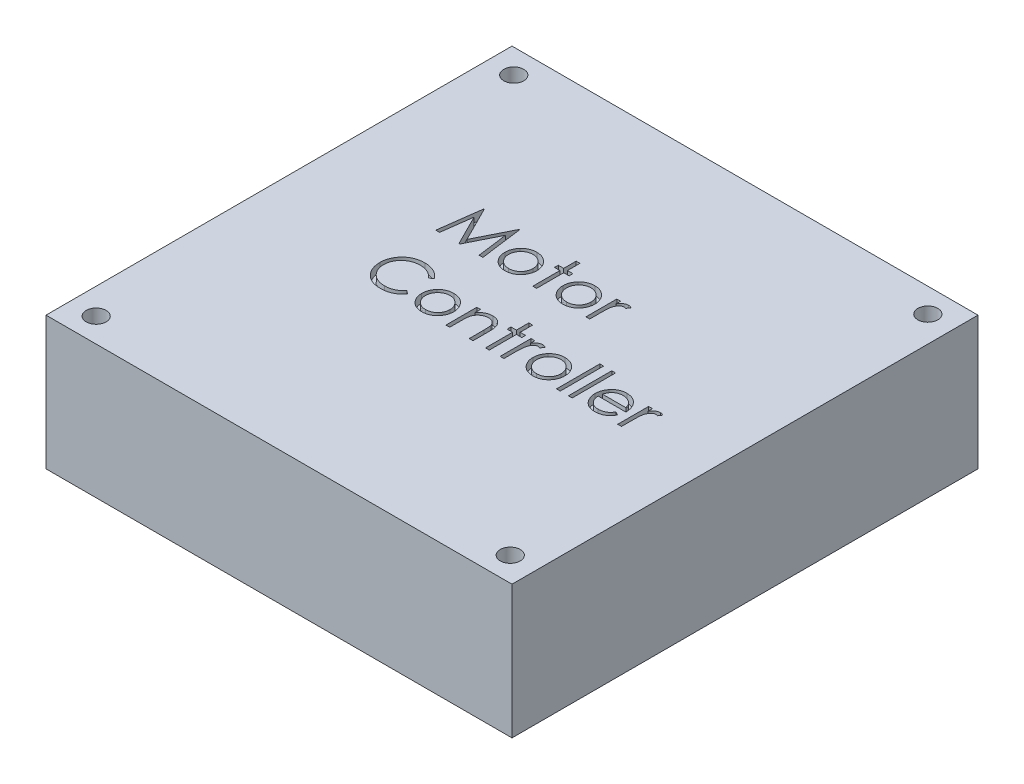
from build123d import *

# Parameters (mm, degrees)
SKETCH1_W             = 70
SKETCH1_H             = 70
BOSS_EXTRUDE1_DEPTH   = 20
SKETCH2_W             = 0.569871795
SKETCH2_H             = 6.512820513
CUT_EXTRUDE1_DEPTH    = 1.27
F_3_0MM_DOWEL_HOLE1_D = 3


with BuildPart() as part:
    # Sketch1 → Boss-Extrude1 (new body)
    with BuildSketch(Plane(origin=(0, 0, 0), x_dir=(1, 0, 0), z_dir=(0, 1, 0))):
        Rectangle(SKETCH1_W, SKETCH1_H)
    extrude(amount=BOSS_EXTRUDE1_DEPTH)

    # Sketch2 → Cut-Extrude1 (cut)
    # profile 1 of 15: a face of its own
    with BuildSketch(Plane(origin=(0, 20, 0), x_dir=(1, 0, 0), z_dir=(0, 1, 0))):
        Polygon((-16.77700151, 5.328013988), (-15.938730276, 11.678013988), (-15.85732002, 11.678013988), (-13.235655356, 6.467757577), (-10.620350869, 11.678013988), (-10.537668577, 11.678013988), (-9.694309202, 5.328013988), (-10.266725068, 5.328013988), (-10.87475792, 9.897164629), (-13.166965452, 5.328013988), (-13.295441013, 5.328013988), (-15.596552792, 9.907340911), (-16.203313609, 5.328013988), align=None)
    # profile 2 of 15: a face of its own
    with BuildSketch(Plane(origin=(0, 20, 0), x_dir=(1, 0, 0), z_dir=(0, 1, 0))):
        with BuildLine():
            add(Edge.make_bspline(
                [(-6.313239491, 10.049808859), (-6.22616961, 10.047954857), (-6.055446853, 10.044319611), (-5.805423974, 10.005466745), (-5.566763513, 9.946053669), (-5.338551422, 9.863918121), (-5.123710428, 9.753823725), (-4.919111171, 9.622452583), (-4.725314598, 9.466818449), (-4.609158531, 9.346425953), (-4.550198625, 9.28531567)],
                knots=[0, 0, 0, 0, 1.054011418, 2.066658804, 3.057071809, 4.030435133, 4.997543892, 5.974964718, 6.972108034, 8, 8, 8, 8], degree=3))
            add(Edge.make_bspline(
                [(-4.550198625, 9.28531567), (-4.499431366, 9.226870296), (-4.398879333, 9.111110627), (-4.269945815, 8.923412586), (-4.158872413, 8.729029832), (-4.069858184, 8.525381111), (-3.999672498, 8.314244207), (-3.949841877, 8.094893416), (-3.92020201, 7.867813157), (-3.916205198, 7.713591908), (-3.914180997, 7.635485943)],
                knots=[0, 0, 0, 0, 1.025258237, 2.030674902, 3.01204498, 3.988269485, 4.97094183, 5.956517959, 6.965070386, 8, 8, 8, 8], degree=3))
            add(Edge.make_bspline(
                [(-3.914180997, 7.635485943), (-3.915961423, 7.556927267), (-3.919479629, 7.401691659), (-3.95276019, 7.173056524), (-4.004523731, 6.951360203), (-4.078604352, 6.737530858), (-4.173596922, 6.530914872), (-4.289512883, 6.332414689), (-4.427165675, 6.141638676), (-4.583201497, 5.96020677), (-4.755652758, 5.792990923), (-4.942734913, 5.647252491), (-5.140771517, 5.522390582), (-5.352395887, 5.421813085), (-5.57567547, 5.342511201), (-5.811091865, 5.286812599), (-6.05827935, 5.253136402), (-6.227057308, 5.248811919), (-6.313239491, 5.246603731)],
                knots=[0, 0, 0, 0, 0.998656419, 1.973391657, 2.932242238, 3.890759089, 4.846373663, 5.82037756, 6.809684879, 7.83454468, 8.860553229, 9.859544525, 10.845671541, 11.83227036, 12.833544569, 13.85385346, 14.904124723, 16, 16, 16, 16], degree=3))
            add(Edge.make_bspline(
                [(-6.313239491, 5.246603731), (-6.39984391, 5.24881933), (-6.569463042, 5.253158692), (-6.817523037, 5.286681762), (-7.053361346, 5.342485531), (-7.276933232, 5.422073696), (-7.489467454, 5.522393797), (-7.688651527, 5.646875005), (-7.87588566, 5.793034144), (-8.048373403, 5.960195058), (-8.204399444, 6.141641693), (-8.342054759, 6.332413906), (-8.457970065, 6.530915076), (-8.552962806, 6.737530804), (-8.627043381, 6.951360217), (-8.678806935, 7.17305652), (-8.712087493, 7.40169166), (-8.715605699, 7.556927267), (-8.717386125, 7.635485943)],
                knots=[0, 0, 0, 0, 1.099876186, 2.154163076, 3.173186993, 4.173200201, 5.163417411, 6.152872554, 7.150605724, 8.17532212, 9.198891216, 10.186952605, 11.159729845, 12.11414092, 13.071450619, 14.029093627, 15.002601286, 16, 16, 16, 16], degree=3))
            add(Edge.make_bspline(
                [(-8.717386125, 7.635485943), (-8.715348119, 7.71316739), (-8.711313218, 7.866963306), (-8.681703151, 8.093616688), (-8.632066913, 8.312596236), (-8.561797094, 8.522918171), (-8.471962391, 8.725674462), (-8.362449768, 8.920537513), (-8.232201049, 9.107386808), (-8.132048937, 9.222996868), (-8.081368497, 9.281499565)],
                knots=[0, 0, 0, 0, 1.031353054, 2.041901799, 3.029428768, 4.008703097, 4.981709435, 5.96992636, 6.972712378, 8, 8, 8, 8], degree=3))
            add(Edge.make_bspline(
                [(-8.081368497, 9.281499565), (-8.022497482, 9.343139811), (-7.906717272, 9.464366203), (-7.711956009, 9.61954664), (-7.507860076, 9.753651517), (-7.290644853, 9.861558365), (-7.062620239, 9.946536818), (-6.822736756, 10.005619967), (-6.571865464, 10.044179625), (-6.400307294, 10.047913748), (-6.313239491, 10.049808859)],
                knots=[0, 0, 0, 0, 1.027980169, 2.021703884, 2.998553061, 3.971491411, 4.943284454, 5.930300938, 6.949603206, 8, 8, 8, 8], degree=3))
        make_face()
        with BuildLine():
            add(Edge.make_bspline(
                [(-6.315783561, 9.479937065), (-6.377356085, 9.47818702), (-6.498911647, 9.474732107), (-6.67783575, 9.448454166), (-6.850084315, 9.406820837), (-7.015984133, 9.347667763), (-7.174975745, 9.271288332), (-7.327211375, 9.177474593), (-7.473138802, 9.067469086), (-7.609903403, 8.941443954), (-7.735419883, 8.803777778), (-7.845144212, 8.657095755), (-7.938444048, 8.503777098), (-8.016168337, 8.343662373), (-8.074057092, 8.175128993), (-8.116099576, 8.000085562), (-8.142352726, 7.818175449), (-8.145775156, 7.694511888), (-8.14751433, 7.631669837)],
                knots=[0, 0, 0, 0, 1.021534396, 2.016698045, 2.994645724, 3.958388632, 4.93408049, 5.916473867, 6.921342795, 7.962252576, 8.998418191, 10.008913653, 10.997312074, 11.973003931, 12.956656626, 13.948281152, 14.957379055, 16, 16, 16, 16], degree=3))
            add(Edge.make_bspline(
                [(-8.14751433, 7.631669837), (-8.144599093, 7.550476873), (-8.138812893, 7.389324023), (-8.091758964, 7.151995272), (-8.013043856, 6.924153912), (-7.906749791, 6.707135612), (-7.773569937, 6.506344479), (-7.616657688, 6.327326214), (-7.437697089, 6.172774813), (-7.238821438, 6.044539565), (-7.02409289, 5.942649723), (-6.796842136, 5.870443009), (-6.559822591, 5.823504368), (-6.397841836, 5.818838978), (-6.315783561, 5.816475526)],
                knots=[0, 0, 0, 0, 1.016792936, 2.018143844, 3.017858371, 4.030088057, 5.03801393, 6.028138512, 7.003788237, 7.991172063, 8.984598303, 9.972568034, 10.972917682, 12, 12, 12, 12], degree=3))
            add(Edge.make_bspline(
                [(-6.315783561, 5.816475526), (-6.233730006, 5.818852749), (-6.071758568, 5.823545321), (-5.835068347, 5.870206608), (-5.608438712, 5.942966106), (-5.393933195, 6.044424973), (-5.195148072, 6.173261783), (-5.01490038, 6.326453495), (-4.8593279, 6.506818626), (-4.726279788, 6.707401571), (-4.618244983, 6.923817467), (-4.539898317, 7.152037324), (-4.492731269, 7.389313314), (-4.486960336, 7.550473285), (-4.484052792, 7.631669837)],
                knots=[0, 0, 0, 0, 1.02726834, 2.027799167, 3.010890988, 4.004497153, 4.992059811, 5.971914811, 6.958719428, 7.966827853, 8.981595046, 9.981490638, 10.983022906, 12, 12, 12, 12], degree=3))
            add(Edge.make_bspline(
                [(-4.484052792, 7.631669837), (-4.485791368, 7.694512263), (-4.489212619, 7.818176564), (-4.51547434, 8.000081301), (-4.557485105, 8.175144626), (-4.615490753, 8.34360469), (-4.692877321, 8.504191662), (-4.78797636, 8.656645595), (-4.897252649, 8.8042859), (-5.024283711, 8.940998934), (-5.160905554, 9.067518215), (-5.306892123, 9.17751725), (-5.458902013, 9.27087603), (-5.617431727, 9.348321067), (-5.783352814, 9.40628267), (-5.955360034, 9.448694558), (-6.133520732, 9.474621058), (-6.254640711, 9.478153729), (-6.315783561, 9.479937065)],
                knots=[0, 0, 0, 0, 1.042956736, 2.052379634, 3.044323526, 4.02829302, 5.004299113, 5.996692471, 7.007513377, 8.048758398, 9.090003419, 10.095195979, 11.07790575, 12.047570684, 13.018257071, 13.989683339, 14.985167495, 16, 16, 16, 16], degree=3))
        make_face(mode=Mode.SUBTRACT)
    # profile 3 of 15: a face of its own
    with BuildSketch(Plane(origin=(0, 20, 0), x_dir=(1, 0, 0), z_dir=(0, 1, 0))):
        Polygon((-2.204565613, 11.8408345), (-1.634693818, 11.8408345), (-1.634693818, 9.968398603), (-0.820591254, 9.968398603), (-0.820591254, 9.398526808), (-1.634693818, 9.398526808), (-1.634693818, 5.328013988), (-2.204565613, 5.328013988), (-2.204565613, 9.398526808), (-3.018668177, 9.398526808), (-3.018668177, 9.968398603), (-2.204565613, 9.968398603), align=None)
    # profile 4 of 15: a face of its own
    with BuildSketch(Plane(origin=(0, 20, 0), x_dir=(1, 0, 0), z_dir=(0, 1, 0))):
        with BuildLine():
            add(Edge.make_bspline(
                [(2.397657945, 10.049808859), (2.484727826, 10.047954857), (2.655450583, 10.044319611), (2.905473462, 10.005466745), (3.144133923, 9.946053669), (3.372346014, 9.863918121), (3.587187007, 9.753823725), (3.791786265, 9.622452583), (3.985582838, 9.466818449), (4.101738905, 9.346425953), (4.160698811, 9.28531567)],
                knots=[0, 0, 0, 0, 1.054011418, 2.066658804, 3.057071809, 4.030435133, 4.997543892, 5.974964718, 6.972108034, 8, 8, 8, 8], degree=3))
            add(Edge.make_bspline(
                [(4.160698811, 9.28531567), (4.21146607, 9.226870296), (4.312018103, 9.111110627), (4.440951621, 8.923412586), (4.552025023, 8.729029832), (4.641039252, 8.525381111), (4.711224938, 8.314244207), (4.761055559, 8.094893416), (4.790695426, 7.867813157), (4.794692238, 7.713591908), (4.796716439, 7.635485943)],
                knots=[0, 0, 0, 0, 1.025258237, 2.030674902, 3.01204498, 3.988269485, 4.97094183, 5.956517959, 6.965070386, 8, 8, 8, 8], degree=3))
            add(Edge.make_bspline(
                [(4.796716439, 7.635485943), (4.794936012, 7.556927267), (4.791417807, 7.401691659), (4.758137246, 7.173056524), (4.706373704, 6.951360203), (4.632293084, 6.737530858), (4.537300514, 6.530914872), (4.421384552, 6.332414689), (4.283731761, 6.141638676), (4.127695939, 5.96020677), (3.955244678, 5.792990923), (3.768162523, 5.647252491), (3.570125919, 5.522390582), (3.358501549, 5.421813085), (3.135221966, 5.342511201), (2.899805571, 5.286812599), (2.652618086, 5.253136402), (2.483840127, 5.248811919), (2.397657945, 5.246603731)],
                knots=[0, 0, 0, 0, 0.998656419, 1.973391657, 2.932242238, 3.890759089, 4.846373663, 5.82037756, 6.809684879, 7.83454468, 8.860553229, 9.859544525, 10.845671541, 11.83227036, 12.833544569, 13.85385346, 14.904124723, 16, 16, 16, 16], degree=3))
            add(Edge.make_bspline(
                [(2.397657945, 5.246603731), (2.311053525, 5.24881933), (2.141434394, 5.253158692), (1.893374399, 5.286681762), (1.65753609, 5.342485531), (1.433964204, 5.422073696), (1.221429982, 5.522393797), (1.022245909, 5.646875005), (0.835011776, 5.793034144), (0.662524033, 5.960195058), (0.506497992, 6.141641693), (0.368842677, 6.332413906), (0.252927371, 6.530915076), (0.157934629, 6.737530804), (0.083854055, 6.951360217), (0.032090501, 7.17305652), (-0.001190057, 7.40169166), (-0.004708263, 7.556927267), (-0.006488689, 7.635485943)],
                knots=[0, 0, 0, 0, 1.099876186, 2.154163076, 3.173186993, 4.173200201, 5.163417411, 6.152872554, 7.150605724, 8.17532212, 9.198891216, 10.186952605, 11.159729845, 12.11414092, 13.071450619, 14.029093627, 15.002601286, 16, 16, 16, 16], degree=3))
            add(Edge.make_bspline(
                [(-0.006488689, 7.635485943), (-0.004450684, 7.71316739), (-0.000415782, 7.866963306), (0.029194284, 8.093616688), (0.078830523, 8.312596236), (0.149100342, 8.522918171), (0.238935045, 8.725674462), (0.348447668, 8.920537513), (0.478696387, 9.107386808), (0.578848499, 9.222996868), (0.629528939, 9.281499565)],
                knots=[0, 0, 0, 0, 1.031353054, 2.041901799, 3.029428768, 4.008703097, 4.981709435, 5.96992636, 6.972712378, 8, 8, 8, 8], degree=3))
            add(Edge.make_bspline(
                [(0.629528939, 9.281499565), (0.688399954, 9.343139811), (0.804180164, 9.464366203), (0.998941427, 9.61954664), (1.20303736, 9.753651517), (1.420252583, 9.861558365), (1.648277197, 9.946536818), (1.88816068, 10.005619967), (2.139031972, 10.044179625), (2.310590142, 10.047913748), (2.397657945, 10.049808859)],
                knots=[0, 0, 0, 0, 1.027980169, 2.021703884, 2.998553061, 3.971491411, 4.943284454, 5.930300938, 6.949603206, 8, 8, 8, 8], degree=3))
        make_face()
        with BuildLine():
            add(Edge.make_bspline(
                [(2.395113875, 9.479937065), (2.333541351, 9.47818702), (2.211985789, 9.474732107), (2.033061686, 9.448454166), (1.860813121, 9.406820837), (1.694913303, 9.347667763), (1.535921691, 9.271288332), (1.38368606, 9.177474593), (1.237758634, 9.067469086), (1.100994033, 8.941443954), (0.975477552, 8.803777778), (0.865753224, 8.657095755), (0.772453388, 8.503777098), (0.694729099, 8.343662373), (0.636840344, 8.175128993), (0.59479786, 8.000085562), (0.56854471, 7.818175449), (0.56512228, 7.694511888), (0.563383105, 7.631669837)],
                knots=[0, 0, 0, 0, 1.021534396, 2.016698045, 2.994645724, 3.958388632, 4.93408049, 5.916473867, 6.921342795, 7.962252576, 8.998418191, 10.008913653, 10.997312074, 11.973003931, 12.956656626, 13.948281152, 14.957379055, 16, 16, 16, 16], degree=3))
            add(Edge.make_bspline(
                [(0.563383105, 7.631669837), (0.566298343, 7.550476873), (0.572084543, 7.389324023), (0.619138472, 7.151995272), (0.69785358, 6.924153912), (0.804147645, 6.707135612), (0.937327498, 6.506344479), (1.094239748, 6.327326214), (1.273200347, 6.172774813), (1.472075998, 6.044539565), (1.686804546, 5.942649723), (1.9140553, 5.870443009), (2.151074845, 5.823504368), (2.3130556, 5.818838978), (2.395113875, 5.816475526)],
                knots=[0, 0, 0, 0, 1.016792936, 2.018143844, 3.017858371, 4.030088057, 5.03801393, 6.028138512, 7.003788237, 7.991172063, 8.984598303, 9.972568034, 10.972917682, 12, 12, 12, 12], degree=3))
            add(Edge.make_bspline(
                [(2.395113875, 5.816475526), (2.47716743, 5.818852749), (2.639138868, 5.823545321), (2.875829089, 5.870206608), (3.102458724, 5.942966106), (3.316964241, 6.044424973), (3.515749364, 6.173261783), (3.695997056, 6.326453495), (3.851569536, 6.506818626), (3.984617648, 6.707401571), (4.092652453, 6.923817467), (4.170999119, 7.152037324), (4.218166167, 7.389313314), (4.223937099, 7.550473285), (4.226844644, 7.631669837)],
                knots=[0, 0, 0, 0, 1.02726834, 2.027799167, 3.010890988, 4.004497153, 4.992059811, 5.971914811, 6.958719428, 7.966827853, 8.981595046, 9.981490638, 10.983022906, 12, 12, 12, 12], degree=3))
            add(Edge.make_bspline(
                [(4.226844644, 7.631669837), (4.225106068, 7.694512263), (4.221684817, 7.818176564), (4.195423096, 8.000081301), (4.153412331, 8.175144626), (4.095406683, 8.34360469), (4.018020115, 8.504191662), (3.922921076, 8.656645595), (3.813644787, 8.8042859), (3.686613725, 8.940998934), (3.549991882, 9.067518215), (3.404005313, 9.17751725), (3.251995423, 9.27087603), (3.093465709, 9.348321067), (2.927544622, 9.40628267), (2.755537401, 9.448694558), (2.577376703, 9.474621058), (2.456256725, 9.478153729), (2.395113875, 9.479937065)],
                knots=[0, 0, 0, 0, 1.042956736, 2.052379634, 3.044323526, 4.02829302, 5.004299113, 5.996692471, 7.007513377, 8.048758398, 9.090003419, 10.095195979, 11.07790575, 12.047570684, 13.018257071, 13.989683339, 14.985167495, 16, 16, 16, 16], degree=3))
        make_face(mode=Mode.SUBTRACT)
    # profile 5 of 15: a face of its own
    with BuildSketch(Plane(origin=(0, 20, 0), x_dir=(1, 0, 0), z_dir=(0, 1, 0))):
        with BuildLine():
            Line((5.773639516, 9.968398603), (6.343511311, 9.968398603))
            Line((6.343511311, 9.968398603), (6.343511311, 9.28531567))
            add(Edge.make_bspline(
                [(6.343511311, 9.28531567), (6.385582344, 9.348916959), (6.466042869, 9.470553929), (6.599779184, 9.631425375), (6.736763799, 9.764621245), (6.877652496, 9.870763344), (7.023481335, 9.950252859), (7.171049804, 10.008478794), (7.322679585, 10.042909066), (7.424573362, 10.047505847), (7.475622689, 10.049808859)],
                knots=[0, 0, 0, 0, 1.2804753, 2.448899062, 3.506932113, 4.484331642, 5.4025378, 6.288909075, 7.142734305, 8, 8, 8, 8], degree=3))
            add(Edge.make_bspline(
                [(7.475622689, 10.049808859), (7.515221881, 10.047648904), (7.596699793, 10.043204655), (7.720039634, 10.011979302), (7.847118469, 9.962126318), (7.929019657, 9.915244772), (7.971716439, 9.890804452)],
                knots=[0, 0, 0, 0, 0.901110191, 1.854092781, 2.881294221, 4, 4, 4, 4], degree=3))
            Line((7.971716439, 9.890804452), (7.658795766, 9.397254773))
            add(Edge.make_bspline(
                [(7.658795766, 9.397254773), (7.631383684, 9.409483541), (7.579350307, 9.432696085), (7.503232736, 9.460168018), (7.43305374, 9.476344036), (7.388343284, 9.478794624), (7.367499692, 9.479937065)],
                knots=[0, 0, 0, 0, 1.180555205, 2.24091978, 3.179933427, 4, 4, 4, 4], degree=3))
            add(Edge.make_bspline(
                [(7.367499692, 9.479937065), (7.32176929, 9.476888997), (7.228492525, 9.470671822), (7.091542076, 9.421797128), (6.958650718, 9.342829907), (6.853110702, 9.255252318), (6.771391186, 9.170801314), (6.713079634, 9.097053498), (6.659589507, 9.014360838), (6.608480679, 8.924136983), (6.561914688, 8.824841405), (6.518454074, 8.717466146), (6.479158708, 8.601886841), (6.456751836, 8.521364269), (6.445274131, 8.480117353)],
                knots=[0, 0, 0, 0, 1.125678352, 2.296057538, 3.5422874, 4.923748041, 5.663163013, 6.437101912, 7.23742474, 8.08941207, 8.991984279, 9.93940061, 10.944477711, 12, 12, 12, 12], degree=3))
            add(Edge.make_bspline(
                [(6.445274131, 8.480117353), (6.436688217, 8.443328767), (6.417671071, 8.361844843), (6.39918071, 8.225141091), (6.380911727, 8.063626739), (6.368036434, 7.876852206), (6.356101986, 7.665283915), (6.349370837, 7.428599557), (6.343740853, 7.166556191), (6.343590146, 6.983359864), (6.343511311, 6.887529212)],
                knots=[0, 0, 0, 0, 0.566838948, 1.255505196, 2.06880316, 3.007127437, 4.065329342, 5.249902469, 6.561414163, 8, 8, 8, 8], degree=3))
            Line((6.343511311, 6.887529212), (6.343511311, 5.328013988))
            Line((6.343511311, 5.328013988), (5.773639516, 5.328013988))
            Line((5.773639516, 5.328013988), (5.773639516, 9.968398603))
        make_face()
    # profile 6 of 15: a face of its own
    with BuildSketch(Plane(origin=(0, 20, 0), x_dir=(1, 0, 0), z_dir=(0, 1, 0))):
        with BuildLine():
            Line((-10.589822023, -1.070503641), (-11.088459843, -1.452114218))
            add(Edge.make_bspline(
                [(-11.088459843, -1.452114218), (-11.124030526, -1.409721672), (-11.194692323, -1.325508125), (-11.308374019, -1.207253809), (-11.426849857, -1.096463977), (-11.550074548, -0.992610853), (-11.680266093, -0.899326149), (-11.814270685, -0.811748577), (-11.954329996, -0.733248538), (-12.148008143, -0.638065692), (-12.401369239, -0.538740525), (-12.720311304, -0.455458948), (-13.053252869, -0.402443386), (-13.280397085, -0.39670146), (-13.395931798, -0.393780884)],
                knots=[0, 0, 0, 0, 0.757959112, 1.505699292, 2.245454638, 2.979532153, 3.711538275, 4.438200793, 5.171680507, 5.909471876, 7.393775596, 8.890124382, 10.418191784, 12, 12, 12, 12], degree=3))
            add(Edge.make_bspline(
                [(-13.395931798, -0.393780884), (-13.459582927, -0.394513788), (-13.586294442, -0.395972792), (-13.774342387, -0.415220777), (-13.958878923, -0.442273972), (-14.139784011, -0.48241563), (-14.316827379, -0.533165953), (-14.491166451, -0.593809204), (-14.660277111, -0.668838699), (-14.826498772, -0.751766542), (-14.98575534, -0.845433478), (-15.136440927, -0.947601988), (-15.278005954, -1.057128777), (-15.410562408, -1.174424356), (-15.5342458, -1.298960484), (-15.648159921, -1.432064361), (-15.751910594, -1.573310447), (-15.847554339, -1.720836201), (-15.933211727, -1.874211908), (-16.004930222, -2.03400525), (-16.068439516, -2.197479837), (-16.118693856, -2.366482658), (-16.158471193, -2.539824533), (-16.185917097, -2.717970677), (-16.20494618, -2.900548924), (-16.20639793, -3.024300106), (-16.207129715, -3.086679522)],
                knots=[0, 0, 0, 0, 1.054917814, 2.100044995, 3.131103042, 4.146048494, 5.169673617, 6.183595914, 7.203665975, 8.234915748, 9.262203917, 10.264457458, 11.251630812, 12.227803204, 13.197192746, 14.159520551, 15.12972552, 16.100847026, 17.073214652, 18.039054194, 19.002613845, 19.979014051, 20.95965708, 21.949030935, 22.966165397, 24, 24, 24, 24], degree=3))
            add(Edge.make_bspline(
                [(-16.207129715, -3.086679522), (-16.204840415, -3.180534917), (-16.200345678, -3.364807535), (-16.1603437, -3.634719928), (-16.099555891, -3.893293151), (-16.008450488, -4.138910865), (-15.896111639, -4.374601743), (-15.754160815, -4.596377948), (-15.589756526, -4.807590858), (-15.400572936, -5.003248778), (-15.193008099, -5.181980822), (-14.970308316, -5.339371163), (-14.733028251, -5.470571021), (-14.483787794, -5.579747381), (-14.220668987, -5.663670301), (-13.944144988, -5.722750926), (-13.654817225, -5.76129031), (-13.4571156, -5.764980001), (-13.356498705, -5.766857807)],
                knots=[0, 0, 0, 0, 1.029171465, 2.020641659, 2.987623507, 3.938342917, 4.889210282, 5.84687017, 6.821220943, 7.821438502, 8.827599549, 9.822697543, 10.807740252, 11.797342354, 12.80366471, 13.83203677, 14.896651826, 16, 16, 16, 16], degree=3))
            add(Edge.make_bspline(
                [(-13.356498705, -5.766857807), (-13.24564097, -5.763793878), (-13.027446426, -5.757763333), (-12.707464436, -5.70667441), (-12.401148118, -5.623837902), (-12.108480997, -5.507908814), (-11.830288139, -5.357204649), (-11.566134198, -5.174509928), (-11.315796206, -4.95808681), (-11.165262594, -4.792835992), (-11.088459843, -4.708524474)],
                knots=[0, 0, 0, 0, 1.028121516, 2.023589091, 2.998037872, 3.967518031, 4.937445131, 5.927275754, 6.942489185, 8, 8, 8, 8], degree=3))
            Line((-11.088459843, -4.708524474), (-10.589822023, -5.086318945))
            add(Edge.make_bspline(
                [(-10.589822023, -5.086318945), (-10.629950594, -5.138095851), (-10.710015522, -5.241401654), (-10.839660781, -5.38703747), (-10.976235306, -5.524023363), (-11.120753523, -5.651254904), (-11.271552945, -5.771278006), (-11.431341283, -5.880682757), (-11.598017956, -5.980996218), (-11.771018225, -6.072847924), (-11.95015828, -6.154340644), (-12.135223469, -6.224106766), (-12.325416084, -6.284204779), (-12.520744821, -6.333647579), (-12.721614837, -6.372239403), (-12.927301269, -6.398037955), (-13.138248042, -6.415712572), (-13.280563192, -6.417323505), (-13.3526826, -6.418139859)],
                knots=[0, 0, 0, 0, 0.986787822, 1.968848986, 2.935600012, 3.899624008, 4.868462664, 5.837806735, 6.815139263, 7.798259679, 8.787526145, 9.778297419, 10.776456485, 11.791383307, 12.812564526, 13.85620153, 14.913611965, 16, 16, 16, 16], degree=3))
            add(Edge.make_bspline(
                [(-13.3526826, -6.418139859), (-13.420978967, -6.417664529), (-13.556026576, -6.416724624), (-13.755414311, -6.401498835), (-13.949523979, -6.380725741), (-14.137800801, -6.349447217), (-14.321272212, -6.312536772), (-14.498274987, -6.26305892), (-14.670550869, -6.207634004), (-14.837407715, -6.142492099), (-14.998987457, -6.068984168), (-15.154768943, -5.985905197), (-15.304680527, -5.893953814), (-15.450196077, -5.795156866), (-15.589165978, -5.686340905), (-15.722794517, -5.569017153), (-15.85183101, -5.443581048), (-15.931664453, -5.3531301), (-15.971803193, -5.30765308)],
                knots=[0, 0, 0, 0, 1.114604814, 2.203992996, 3.262667896, 4.300477797, 5.318619304, 6.316056647, 7.298880507, 8.271930387, 9.238335007, 10.195173496, 11.151986948, 12.108099108, 13.064862484, 14.031167946, 15.010108607, 16, 16, 16, 16], degree=3))
            add(Edge.make_bspline(
                [(-15.971803193, -5.30765308), (-16.036093574, -5.228656923), (-16.163898168, -5.07161832), (-16.327411908, -4.817099468), (-16.467379616, -4.551364289), (-16.580547358, -4.273016704), (-16.669016888, -3.982681301), (-16.730305627, -3.680211725), (-16.77013211, -3.365890458), (-16.774686491, -3.152100856), (-16.77700151, -3.043430323)],
                knots=[0, 0, 0, 0, 0.994628077, 1.977248131, 2.950237994, 3.925870899, 4.908910175, 5.911660606, 6.938484602, 8, 8, 8, 8], degree=3))
            add(Edge.make_bspline(
                [(-16.77700151, -3.043430323), (-16.774179944, -2.929211143), (-16.768628691, -2.704492037), (-16.72146489, -2.374702151), (-16.645593646, -2.058741756), (-16.537830719, -1.757200676), (-16.401205296, -1.468492882), (-16.23242844, -1.194823839), (-16.03346091, -0.93444336), (-15.80586318, -0.691302311), (-15.556276729, -0.468980914), (-15.28899831, -0.273389658), (-15.004551063, -0.110616451), (-14.706068675, 0.025448015), (-14.391316081, 0.130031541), (-14.060964826, 0.203243751), (-13.715635652, 0.248813377), (-13.480028108, 0.254574111), (-13.360314811, 0.257501167)],
                knots=[0, 0, 0, 0, 1.032925535, 2.032216505, 3.007276963, 3.968222605, 4.92396291, 5.891752235, 6.871517503, 7.883894988, 8.900124299, 9.891468569, 10.874487609, 11.85992873, 12.854644235, 13.869047385, 14.917252991, 16, 16, 16, 16], degree=3))
            add(Edge.make_bspline(
                [(-13.360314811, 0.257501167), (-13.287354269, 0.256626431), (-13.142936224, 0.254894978), (-12.929299269, 0.238010977), (-12.721305333, 0.209864863), (-12.518811123, 0.171554279), (-12.320831519, 0.12400671), (-12.128879654, 0.062066455), (-11.941829179, -0.008756966), (-11.760859788, -0.090324469), (-11.586839762, -0.181885557), (-11.419823298, -0.282425331), (-11.261137054, -0.391819149), (-11.109664429, -0.509136625), (-10.967939303, -0.636859725), (-10.831937764, -0.771475364), (-10.706278379, -0.916861016), (-10.628711868, -1.019195682), (-10.589822023, -1.070503641)],
                knots=[0, 0, 0, 0, 1.096760587, 2.17092713, 3.219439832, 4.250915756, 5.268269357, 6.278326846, 7.281116186, 8.274029601, 9.260640565, 10.235837813, 11.203064059, 12.156899882, 13.114053108, 14.069676657, 15.032185724, 16, 16, 16, 16], degree=3))
        make_face()
    # profile 7 of 15: a face of its own
    with BuildSketch(Plane(origin=(0, 20, 0), x_dir=(1, 0, 0), z_dir=(0, 1, 0))):
        with BuildLine():
            add(Edge.make_bspline(
                [(-7.208752311, -1.533524474), (-7.121682431, -1.535378476), (-6.950959673, -1.539013722), (-6.700936795, -1.577866588), (-6.462276334, -1.637279664), (-6.234064242, -1.719415212), (-6.019223249, -1.829509608), (-5.814623992, -1.960880751), (-5.620827419, -2.116514885), (-5.504671351, -2.23690738), (-5.445711446, -2.298017663)],
                knots=[0, 0, 0, 0, 1.054011418, 2.066658804, 3.057071809, 4.030435133, 4.997543892, 5.974964718, 6.972108034, 8, 8, 8, 8], degree=3))
            add(Edge.make_bspline(
                [(-5.445711446, -2.298017663), (-5.394944186, -2.356463037), (-5.294392154, -2.472222707), (-5.165458635, -2.659920747), (-5.054385233, -2.854303501), (-4.965371004, -3.057952223), (-4.895185318, -3.269089126), (-4.845354698, -3.488439918), (-4.81571483, -3.715520176), (-4.811718019, -3.869741425), (-4.809693818, -3.947847391)],
                knots=[0, 0, 0, 0, 1.025258237, 2.030674902, 3.01204498, 3.988269485, 4.97094183, 5.956517959, 6.965070386, 8, 8, 8, 8], degree=3))
            add(Edge.make_bspline(
                [(-4.809693818, -3.947847391), (-4.811474244, -4.026406067), (-4.814992449, -4.181641674), (-4.84827301, -4.410276809), (-4.900036552, -4.631973131), (-4.974117173, -4.845802475), (-5.069109742, -5.052418462), (-5.185025704, -5.250918644), (-5.322678495, -5.441694657), (-5.478714318, -5.623126564), (-5.651165579, -5.790342411), (-5.838247734, -5.936080843), (-6.036284338, -6.060942751), (-6.247908707, -6.161520248), (-6.47118829, -6.240822133), (-6.706604685, -6.296520734), (-6.95379217, -6.330196932), (-7.122570129, -6.334521415), (-7.208752311, -6.336729602)],
                knots=[0, 0, 0, 0, 0.998656419, 1.973391657, 2.932242238, 3.890759089, 4.846373663, 5.82037756, 6.809684879, 7.83454468, 8.860553229, 9.859544525, 10.845671541, 11.83227036, 12.833544569, 13.85385346, 14.904124723, 16, 16, 16, 16], degree=3))
            add(Edge.make_bspline(
                [(-7.208752311, -6.336729602), (-7.295356731, -6.334514003), (-7.464975862, -6.330174641), (-7.713035858, -6.296651571), (-7.948874167, -6.240847803), (-8.172446052, -6.161259637), (-8.384980275, -6.060939536), (-8.584164348, -5.936458328), (-8.77139848, -5.790299189), (-8.943886223, -5.623138275), (-9.099912264, -5.44169164), (-9.23756758, -5.250919427), (-9.353482886, -5.052418258), (-9.448475627, -4.845802529), (-9.522556202, -4.631973116), (-9.574319756, -4.410276813), (-9.607600314, -4.181641673), (-9.611118519, -4.026406066), (-9.612898946, -3.947847391)],
                knots=[0, 0, 0, 0, 1.099876186, 2.154163076, 3.173186993, 4.173200201, 5.163417411, 6.152872554, 7.150605724, 8.17532212, 9.198891216, 10.186952605, 11.159729845, 12.11414092, 13.071450619, 14.029093627, 15.002601286, 16, 16, 16, 16], degree=3))
            add(Edge.make_bspline(
                [(-9.612898946, -3.947847391), (-9.61086094, -3.870165943), (-9.606826038, -3.716370027), (-9.577215972, -3.489716646), (-9.527579734, -3.270737097), (-9.457309914, -3.060415162), (-9.367475211, -2.857658871), (-9.257962589, -2.66279582), (-9.12771387, -2.475946525), (-9.027561758, -2.360336466), (-8.976881318, -2.301833769)],
                knots=[0, 0, 0, 0, 1.031353054, 2.041901799, 3.029428768, 4.008703097, 4.981709435, 5.96992636, 6.972712378, 8, 8, 8, 8], degree=3))
            add(Edge.make_bspline(
                [(-8.976881318, -2.301833769), (-8.918010302, -2.240193522), (-8.802230092, -2.11896713), (-8.607468829, -1.963786694), (-8.403372897, -1.829681817), (-8.186157673, -1.721774969), (-7.95813306, -1.636796515), (-7.718249577, -1.577713366), (-7.467378285, -1.539153708), (-7.295820115, -1.535419585), (-7.208752311, -1.533524474)],
                knots=[0, 0, 0, 0, 1.027980169, 2.021703884, 2.998553061, 3.971491411, 4.943284454, 5.930300938, 6.949603206, 8, 8, 8, 8], degree=3))
        make_face()
        with BuildLine():
            add(Edge.make_bspline(
                [(-7.211296382, -2.103396269), (-7.272868905, -2.105146314), (-7.394424467, -2.108601226), (-7.573348571, -2.134879168), (-7.745597136, -2.176512497), (-7.911496953, -2.23566557), (-8.070488566, -2.312045001), (-8.222724196, -2.40585874), (-8.368651623, -2.515864247), (-8.505416223, -2.64188938), (-8.630932704, -2.779555556), (-8.740657033, -2.926237578), (-8.833956869, -3.079556235), (-8.911681157, -3.239670961), (-8.969569913, -3.40820434), (-9.011612396, -3.583247771), (-9.037865547, -3.765157884), (-9.041287977, -3.888821446), (-9.043027151, -3.951663496)],
                knots=[0, 0, 0, 0, 1.021534396, 2.016698045, 2.994645724, 3.958388632, 4.93408049, 5.916473867, 6.921342795, 7.962252576, 8.998418191, 10.008913653, 10.997312074, 11.973003931, 12.956656626, 13.948281152, 14.957379055, 16, 16, 16, 16], degree=3))
            add(Edge.make_bspline(
                [(-9.043027151, -3.951663496), (-9.040111914, -4.03285646), (-9.034325713, -4.19400931), (-8.987271784, -4.431338061), (-8.908556676, -4.659179421), (-8.802262612, -4.876197722), (-8.669082758, -5.076988855), (-8.512170508, -5.256007119), (-8.333209909, -5.41055852), (-8.134334259, -5.538793768), (-7.919605711, -5.640683611), (-7.692354957, -5.712890324), (-7.455335412, -5.759828966), (-7.293354657, -5.764494355), (-7.211296382, -5.766857807)],
                knots=[0, 0, 0, 0, 1.016792936, 2.018143844, 3.017858371, 4.030088057, 5.03801393, 6.028138512, 7.003788237, 7.991172063, 8.984598303, 9.972568034, 10.972917682, 12, 12, 12, 12], degree=3))
            add(Edge.make_bspline(
                [(-7.211296382, -5.766857807), (-7.129242827, -5.764480585), (-6.967271388, -5.759788013), (-6.730581167, -5.713126726), (-6.503951533, -5.640367227), (-6.289446015, -5.53890836), (-6.090660892, -5.410071551), (-5.9104132, -5.256879838), (-5.75484072, -5.076514708), (-5.621792609, -4.875931763), (-5.513757804, -4.659515867), (-5.435411138, -4.43129601), (-5.388244089, -4.194020019), (-5.382473157, -4.032860048), (-5.379565613, -3.951663496)],
                knots=[0, 0, 0, 0, 1.02726834, 2.027799167, 3.010890988, 4.004497153, 4.992059811, 5.971914811, 6.958719428, 7.966827853, 8.981595046, 9.981490638, 10.983022906, 12, 12, 12, 12], degree=3))
            add(Edge.make_bspline(
                [(-5.379565613, -3.951663496), (-5.381304188, -3.88882107), (-5.38472544, -3.765156769), (-5.410987161, -3.583252032), (-5.452997925, -3.408188707), (-5.511003574, -3.239728644), (-5.588390142, -3.079141672), (-5.683489181, -2.926687738), (-5.79276547, -2.779047433), (-5.919796532, -2.642334399), (-6.056418375, -2.515815119), (-6.202404944, -2.405816084), (-6.354414834, -2.312457303), (-6.512944548, -2.235012267), (-6.678865635, -2.177050664), (-6.850872855, -2.134638775), (-7.029033553, -2.108712275), (-7.150153531, -2.105179604), (-7.211296382, -2.103396269)],
                knots=[0, 0, 0, 0, 1.042956736, 2.052379634, 3.044323526, 4.02829302, 5.004299113, 5.996692471, 7.007513377, 8.048758398, 9.090003419, 10.095195979, 11.07790575, 12.047570684, 13.018257071, 13.989683339, 14.985167495, 16, 16, 16, 16], degree=3))
        make_face(mode=Mode.SUBTRACT)
    # profile 8 of 15: a face of its own
    with BuildSketch(Plane(origin=(0, 20, 0), x_dir=(1, 0, 0), z_dir=(0, 1, 0))):
        with BuildLine():
            Line((-3.669950228, -1.61493473), (-3.100078433, -1.61493473))
            Line((-3.100078433, -1.61493473), (-3.100078433, -2.451933929))
            add(Edge.make_bspline(
                [(-3.100078433, -2.451933929), (-3.039231581, -2.376019275), (-2.921156141, -2.22870424), (-2.724515993, -2.035082626), (-2.516700631, -1.87552486), (-2.298982711, -1.748336548), (-2.071066678, -1.65245767), (-1.834341817, -1.583213766), (-1.58739085, -1.541694149), (-1.419452515, -1.536269016), (-1.334493497, -1.533524474)],
                knots=[0, 0, 0, 0, 1.12780773, 2.188550248, 3.19190651, 4.159438251, 5.104880172, 6.052711206, 7.014878035, 8, 8, 8, 8], degree=3))
            add(Edge.make_bspline(
                [(-1.334493497, -1.533524474), (-1.248622204, -1.536690757), (-1.080551369, -1.542887937), (-0.835844029, -1.591903934), (-0.607292301, -1.675624611), (-0.395711107, -1.790309367), (-0.204980305, -1.932923969), (-0.037476646, -2.09907223), (0.101068102, -2.290181981), (0.193954747, -2.467479707), (0.255142708, -2.624757948), (0.293664234, -2.759462767), (0.326377586, -2.909537126), (0.354738043, -3.074527524), (0.373927946, -3.255589955), (0.389063247, -3.451982196), (0.399910306, -3.663640633), (0.400340668, -3.810029228), (0.400562593, -3.885517663)],
                knots=[0, 0, 0, 0, 1.235846778, 2.418850247, 3.575807741, 4.728682307, 5.871620074, 6.994088408, 8.11269785, 9.256955736, 9.865816715, 10.540099792, 11.271859618, 12.076849838, 12.949306005, 13.892391288, 14.913166135, 16, 16, 16, 16], degree=3))
            Line((0.400562593, -3.885517663), (0.400562593, -6.255319346))
            Line((0.400562593, -6.255319346), (-0.169309202, -6.255319346))
            Line((-0.169309202, -6.255319346), (-0.169309202, -4.072506846))
            add(Edge.make_bspline(
                [(-0.169309202, -4.072506846), (-0.169659737, -4.009328981), (-0.17033025, -3.888480479), (-0.172445066, -3.715453823), (-0.177542858, -3.558542459), (-0.184706226, -3.418121521), (-0.195191038, -3.294325846), (-0.206117812, -3.186903301), (-0.219479984, -3.095990274), (-0.231386984, -3.041262196), (-0.236727071, -3.016717583)],
                knots=[0, 0, 0, 0, 1.430800155, 2.736877192, 3.918605307, 4.986035426, 5.920637409, 6.731861385, 7.431261377, 8, 8, 8, 8], degree=3))
            add(Edge.make_bspline(
                [(-0.236727071, -3.016717583), (-0.256004821, -2.944670147), (-0.293108525, -2.806001125), (-0.384791609, -2.617906228), (-0.500568765, -2.457889516), (-0.641897721, -2.326940321), (-0.807413329, -2.225030374), (-0.996656288, -2.154320485), (-1.207800394, -2.110094968), (-1.356307631, -2.105691457), (-1.433712247, -2.103396269)],
                knots=[0, 0, 0, 0, 1.084156227, 2.086665306, 3.027808233, 3.945421172, 4.874247719, 5.839848303, 6.874090471, 8, 8, 8, 8], degree=3))
            add(Edge.make_bspline(
                [(-1.433712247, -2.103396269), (-1.479555045, -2.104259877), (-1.570276756, -2.105968936), (-1.704805991, -2.123116291), (-1.835296991, -2.151162346), (-1.96305937, -2.189024017), (-2.085537796, -2.241025563), (-2.206667295, -2.300043134), (-2.32188671, -2.373609176), (-2.433652874, -2.455597875), (-2.537634682, -2.546455865), (-2.634387524, -2.642330905), (-2.720635075, -2.744430929), (-2.798773958, -2.851110834), (-2.86622595, -2.96383574), (-2.925105124, -3.081518125), (-2.975062742, -3.20431288), (-2.999887055, -3.289539063), (-3.012308, -3.332182327)],
                knots=[0, 0, 0, 0, 1.023777757, 2.026029729, 3.023749952, 4.003683103, 4.997618607, 5.993177895, 7.010360494, 8.046726602, 9.087585522, 10.09234134, 11.086953743, 12.070360549, 13.043493632, 14.017870808, 15.008233677, 16, 16, 16, 16], degree=3))
            add(Edge.make_bspline(
                [(-3.012308, -3.332182327), (-3.019455648, -3.363488195), (-3.035015705, -3.431639433), (-3.051821759, -3.543480022), (-3.067075503, -3.672856691), (-3.079842557, -3.819618466), (-3.087653812, -3.984279183), (-3.096170789, -4.166135631), (-3.099271515, -4.36591296), (-3.099801928, -4.504999174), (-3.100078433, -4.577504843)],
                knots=[0, 0, 0, 0, 0.615963638, 1.340920617, 2.168419149, 3.115676021, 4.16674242, 5.331190069, 6.6087489, 8, 8, 8, 8], degree=3))
            Line((-3.100078433, -4.577504843), (-3.100078433, -6.255319346))
            Line((-3.100078433, -6.255319346), (-3.669950228, -6.255319346))
            Line((-3.669950228, -6.255319346), (-3.669950228, -1.61493473))
        make_face()
    # profile 9 of 15: a face of its own
    with BuildSketch(Plane(origin=(0, 20, 0), x_dir=(1, 0, 0), z_dir=(0, 1, 0))):
        Polygon((2.27299849, 0.257501167), (2.842870285, 0.257501167), (2.842870285, -1.61493473), (3.656972849, -1.61493473), (3.656972849, -2.184806525), (2.842870285, -2.184806525), (2.842870285, -6.255319346), (2.27299849, -6.255319346), (2.27299849, -2.184806525), (1.458895926, -2.184806525), (1.458895926, -1.61493473), (2.27299849, -1.61493473), align=None)
    # profile 10 of 15: a face of its own
    with BuildSketch(Plane(origin=(0, 20, 0), x_dir=(1, 0, 0), z_dir=(0, 1, 0))):
        with BuildLine():
            Line((4.471075413, -1.61493473), (5.040947208, -1.61493473))
            Line((5.040947208, -1.61493473), (5.040947208, -2.298017663))
            add(Edge.make_bspline(
                [(5.040947208, -2.298017663), (5.083018242, -2.234416375), (5.163478767, -2.112779404), (5.297215082, -1.951907958), (5.434199697, -1.818712088), (5.575088394, -1.71256999), (5.720917232, -1.633080474), (5.868485702, -1.574854539), (6.020115483, -1.540424267), (6.12200926, -1.535827486), (6.173058586, -1.533524474)],
                knots=[0, 0, 0, 0, 1.2804753, 2.448899062, 3.506932113, 4.484331642, 5.4025378, 6.288909075, 7.142734305, 8, 8, 8, 8], degree=3))
            add(Edge.make_bspline(
                [(6.173058586, -1.533524474), (6.212657779, -1.535684429), (6.29413569, -1.540128678), (6.417475532, -1.571354031), (6.544554366, -1.621207015), (6.626455554, -1.668088562), (6.669152336, -1.692528881)],
                knots=[0, 0, 0, 0, 0.901110191, 1.854092781, 2.881294221, 4, 4, 4, 4], degree=3))
            Line((6.669152336, -1.692528881), (6.356231663, -2.18607856))
            add(Edge.make_bspline(
                [(6.356231663, -2.18607856), (6.328819582, -2.173849792), (6.276786204, -2.150637248), (6.200668634, -2.123165316), (6.130489637, -2.106989297), (6.085779181, -2.104538709), (6.064935589, -2.103396269)],
                knots=[0, 0, 0, 0, 1.180555205, 2.24091978, 3.179933427, 4, 4, 4, 4], degree=3))
            add(Edge.make_bspline(
                [(6.064935589, -2.103396269), (6.019205187, -2.106444337), (5.925928423, -2.112661511), (5.788977974, -2.161536205), (5.656086615, -2.240503427), (5.550546599, -2.328081015), (5.468827083, -2.412532019), (5.410515531, -2.486279836), (5.357025405, -2.568972496), (5.305916576, -2.65919635), (5.259350585, -2.758491928), (5.215889971, -2.865867187), (5.176594605, -2.981446492), (5.154187734, -3.061969064), (5.142710029, -3.10321598)],
                knots=[0, 0, 0, 0, 1.125678352, 2.296057538, 3.5422874, 4.923748041, 5.663163013, 6.437101912, 7.23742474, 8.08941207, 8.991984279, 9.93940061, 10.944477711, 12, 12, 12, 12], degree=3))
            add(Edge.make_bspline(
                [(5.142710029, -3.10321598), (5.134124115, -3.140004567), (5.115106968, -3.22148849), (5.096616607, -3.358192242), (5.078347624, -3.519706594), (5.065472331, -3.706481127), (5.053537883, -3.918049418), (5.046806734, -4.154733777), (5.04117675, -4.416777142), (5.041026043, -4.599973469), (5.040947208, -4.695804121)],
                knots=[0, 0, 0, 0, 0.566838948, 1.255505196, 2.06880316, 3.007127437, 4.065329342, 5.249902469, 6.561414163, 8, 8, 8, 8], degree=3))
            Line((5.040947208, -4.695804121), (5.040947208, -6.255319346))
            Line((5.040947208, -6.255319346), (4.471075413, -6.255319346))
            Line((4.471075413, -6.255319346), (4.471075413, -1.61493473))
        make_face()
    # profile 11 of 15: a face of its own
    with BuildSketch(Plane(origin=(0, 20, 0), x_dir=(1, 0, 0), z_dir=(0, 1, 0))):
        with BuildLine():
            add(Edge.make_bspline(
                [(9.480350253, -1.533524474), (9.567420134, -1.535378476), (9.738142891, -1.539013722), (9.98816577, -1.577866588), (10.22682623, -1.637279664), (10.455038322, -1.719415212), (10.669879315, -1.829509608), (10.874478572, -1.960880751), (11.068275146, -2.116514885), (11.184431213, -2.23690738), (11.243391118, -2.298017663)],
                knots=[0, 0, 0, 0, 1.054011418, 2.066658804, 3.057071809, 4.030435133, 4.997543892, 5.974964718, 6.972108034, 8, 8, 8, 8], degree=3))
            add(Edge.make_bspline(
                [(11.243391118, -2.298017663), (11.294158378, -2.356463037), (11.39471041, -2.472222707), (11.523643929, -2.659920747), (11.634717331, -2.854303501), (11.72373156, -3.057952223), (11.793917246, -3.269089126), (11.843747866, -3.488439918), (11.873387734, -3.715520176), (11.877384545, -3.869741425), (11.879408746, -3.947847391)],
                knots=[0, 0, 0, 0, 1.025258237, 2.030674902, 3.01204498, 3.988269485, 4.97094183, 5.956517959, 6.965070386, 8, 8, 8, 8], degree=3))
            add(Edge.make_bspline(
                [(11.879408746, -3.947847391), (11.87762832, -4.026406067), (11.874110115, -4.181641674), (11.840829554, -4.410276809), (11.789066012, -4.631973131), (11.714985391, -4.845802475), (11.619992822, -5.052418462), (11.50407686, -5.250918644), (11.366424069, -5.441694657), (11.210388246, -5.623126564), (11.037936985, -5.790342411), (10.85085483, -5.936080843), (10.652818226, -6.060942751), (10.441193857, -6.161520248), (10.217914274, -6.240822133), (9.982497879, -6.296520734), (9.735310394, -6.330196932), (9.566532435, -6.334521415), (9.480350253, -6.336729602)],
                knots=[0, 0, 0, 0, 0.998656419, 1.973391657, 2.932242238, 3.890759089, 4.846373663, 5.82037756, 6.809684879, 7.83454468, 8.860553229, 9.859544525, 10.845671541, 11.83227036, 12.833544569, 13.85385346, 14.904124723, 16, 16, 16, 16], degree=3))
            add(Edge.make_bspline(
                [(9.480350253, -6.336729602), (9.393745833, -6.334514003), (9.224126702, -6.330174641), (8.976066706, -6.296651571), (8.740228398, -6.240847803), (8.516656512, -6.161259637), (8.304122289, -6.060939536), (8.104938216, -5.936458328), (7.917704084, -5.790299189), (7.745216341, -5.623138275), (7.5891903, -5.44169164), (7.451534984, -5.250919427), (7.335619678, -5.052418258), (7.240626937, -4.845802529), (7.166546362, -4.631973116), (7.114782808, -4.410276813), (7.081502251, -4.181641673), (7.077984045, -4.026406066), (7.076203618, -3.947847391)],
                knots=[0, 0, 0, 0, 1.099876186, 2.154163076, 3.173186993, 4.173200201, 5.163417411, 6.152872554, 7.150605724, 8.17532212, 9.198891216, 10.186952605, 11.159729845, 12.11414092, 13.071450619, 14.029093627, 15.002601286, 16, 16, 16, 16], degree=3))
            add(Edge.make_bspline(
                [(7.076203618, -3.947847391), (7.078241624, -3.870165943), (7.082276526, -3.716370027), (7.111886592, -3.489716646), (7.16152283, -3.270737097), (7.23179265, -3.060415162), (7.321627353, -2.857658871), (7.431139975, -2.66279582), (7.561388695, -2.475946525), (7.661540807, -2.360336466), (7.712221246, -2.301833769)],
                knots=[0, 0, 0, 0, 1.031353054, 2.041901799, 3.029428768, 4.008703097, 4.981709435, 5.96992636, 6.972712378, 8, 8, 8, 8], degree=3))
            add(Edge.make_bspline(
                [(7.712221246, -2.301833769), (7.771092262, -2.240193522), (7.886872472, -2.11896713), (8.081633735, -1.963786694), (8.285729667, -1.829681817), (8.502944891, -1.721774969), (8.730969504, -1.636796515), (8.970852987, -1.577713366), (9.22172428, -1.539153708), (9.393282449, -1.535419585), (9.480350253, -1.533524474)],
                knots=[0, 0, 0, 0, 1.027980169, 2.021703884, 2.998553061, 3.971491411, 4.943284454, 5.930300938, 6.949603206, 8, 8, 8, 8], degree=3))
        make_face()
        with BuildLine():
            add(Edge.make_bspline(
                [(9.477806182, -2.103396269), (9.416233659, -2.105146314), (9.294678097, -2.108601226), (9.115753993, -2.134879168), (8.943505428, -2.176512497), (8.777605611, -2.23566557), (8.618613998, -2.312045001), (8.466378368, -2.40585874), (8.320450941, -2.515864247), (8.183686341, -2.64188938), (8.05816986, -2.779555556), (7.948445531, -2.926237578), (7.855145695, -3.079556235), (7.777421407, -3.239670961), (7.719532651, -3.40820434), (7.677490168, -3.583247771), (7.651237017, -3.765157884), (7.647814588, -3.888821446), (7.646075413, -3.951663496)],
                knots=[0, 0, 0, 0, 1.021534396, 2.016698045, 2.994645724, 3.958388632, 4.93408049, 5.916473867, 6.921342795, 7.962252576, 8.998418191, 10.008913653, 10.997312074, 11.973003931, 12.956656626, 13.948281152, 14.957379055, 16, 16, 16, 16], degree=3))
            add(Edge.make_bspline(
                [(7.646075413, -3.951663496), (7.64899065, -4.03285646), (7.654776851, -4.19400931), (7.70183078, -4.431338061), (7.780545888, -4.659179421), (7.886839952, -4.876197722), (8.020019806, -5.076988855), (8.176932056, -5.256007119), (8.355892655, -5.41055852), (8.554768305, -5.538793768), (8.769496854, -5.640683611), (8.996747608, -5.712890324), (9.233767152, -5.759828966), (9.395747908, -5.764494355), (9.477806182, -5.766857807)],
                knots=[0, 0, 0, 0, 1.016792936, 2.018143844, 3.017858371, 4.030088057, 5.03801393, 6.028138512, 7.003788237, 7.991172063, 8.984598303, 9.972568034, 10.972917682, 12, 12, 12, 12], degree=3))
            add(Edge.make_bspline(
                [(9.477806182, -5.766857807), (9.559859737, -5.764480585), (9.721831176, -5.759788013), (9.958521397, -5.713126726), (10.185151031, -5.640367227), (10.399656549, -5.53890836), (10.598441672, -5.410071551), (10.778689364, -5.256879838), (10.934261844, -5.076514708), (11.067309956, -4.875931763), (11.17534476, -4.659515867), (11.253691426, -4.43129601), (11.300858475, -4.194020019), (11.306629407, -4.032860048), (11.309536952, -3.951663496)],
                knots=[0, 0, 0, 0, 1.02726834, 2.027799167, 3.010890988, 4.004497153, 4.992059811, 5.971914811, 6.958719428, 7.966827853, 8.981595046, 9.981490638, 10.983022906, 12, 12, 12, 12], degree=3))
            add(Edge.make_bspline(
                [(11.309536952, -3.951663496), (11.307798376, -3.88882107), (11.304377125, -3.765156769), (11.278115403, -3.583252032), (11.236104639, -3.408188707), (11.17809899, -3.239728644), (11.100712422, -3.079141672), (11.005613383, -2.926687738), (10.896337094, -2.779047433), (10.769306032, -2.642334399), (10.632684189, -2.515815119), (10.48669762, -2.405816084), (10.33468773, -2.312457303), (10.176158016, -2.235012267), (10.010236929, -2.177050664), (9.838229709, -2.134638775), (9.660069011, -2.108712275), (9.538949033, -2.105179604), (9.477806182, -2.103396269)],
                knots=[0, 0, 0, 0, 1.042956736, 2.052379634, 3.044323526, 4.02829302, 5.004299113, 5.996692471, 7.007513377, 8.048758398, 9.090003419, 10.095195979, 11.07790575, 12.047570684, 13.018257071, 13.989683339, 14.985167495, 16, 16, 16, 16], degree=3))
        make_face(mode=Mode.SUBTRACT)
    # profile 12 of 15: a face of its own
    with BuildSketch(Plane(origin=(0, 20, 0), x_dir=(1, 0, 0), z_dir=(0, 1, 0))):
        with Locations((13.222677978, -2.99890909)):
            Rectangle(SKETCH2_W, SKETCH2_H)
    # profile 13 of 15: a face of its own
    with BuildSketch(Plane(origin=(0, 20, 0), x_dir=(1, 0, 0), z_dir=(0, 1, 0))):
        with Locations((15.013703619, -2.99890909)):
            Rectangle(SKETCH2_W, SKETCH2_H)
    # profile 14 of 15: a face of its own
    with BuildSketch(Plane(origin=(0, 20, 0), x_dir=(1, 0, 0), z_dir=(0, 1, 0))):
        with BuildLine():
            Line((20.409677176, -4.78993473), (20.915947208, -5.055790099))
            add(Edge.make_bspline(
                [(20.915947208, -5.055790099), (20.875603671, -5.127351571), (20.797111124, -5.266581858), (20.66212691, -5.457865376), (20.520627007, -5.629946232), (20.366224094, -5.778227176), (20.203537676, -5.907497546), (20.031665574, -6.020596171), (19.849713004, -6.116968344), (19.657671361, -6.198162216), (19.45392789, -6.260590869), (19.237988853, -6.30468567), (19.009440568, -6.331942172), (18.852783928, -6.335108356), (18.772567801, -6.336729602)],
                knots=[0, 0, 0, 0, 1.120438281, 2.179929193, 3.190490725, 4.156257408, 5.095198341, 6.022838206, 6.959905092, 7.901321166, 8.864066838, 9.862729781, 10.905609505, 12, 12, 12, 12], degree=3))
            add(Edge.make_bspline(
                [(18.772567801, -6.336729602), (18.683410213, -6.334648298), (18.509489588, -6.330588278), (18.256324619, -6.295586235), (18.017964817, -6.238486384), (17.794423583, -6.15872033), (17.586248354, -6.054530757), (17.393025374, -5.927604268), (17.21373852, -5.778592892), (17.054037455, -5.606205916), (16.910266411, -5.421725793), (16.783400994, -5.229491546), (16.677342512, -5.029986838), (16.591068491, -4.824481745), (16.521391093, -4.614271538), (16.472828645, -4.39744359), (16.444834674, -4.174584744), (16.440544894, -4.023822435), (16.438383105, -3.947847391)],
                knots=[0, 0, 0, 0, 1.145258523, 2.234067595, 3.276747158, 4.290159414, 5.277019952, 6.260822364, 7.254936242, 8.264827045, 9.274100331, 10.257902744, 11.220704747, 12.172965371, 13.118907548, 14.062713208, 15.023725156, 16, 16, 16, 16], degree=3))
            add(Edge.make_bspline(
                [(16.438383105, -3.947847391), (16.44030469, -3.876555341), (16.444113018, -3.735263914), (16.468117447, -3.526139283), (16.51065935, -3.322887662), (16.569036395, -3.125340164), (16.644422227, -2.933827549), (16.736646396, -2.748233262), (16.845852567, -2.568754794), (16.930167275, -2.45553768), (16.972637913, -2.398508448)],
                knots=[0, 0, 0, 0, 1.024358464, 2.0301432, 3.019427413, 4.004406732, 4.986367066, 5.972626655, 6.978780325, 8, 8, 8, 8], degree=3))
            add(Edge.make_bspline(
                [(16.972637913, -2.398508448), (17.030164709, -2.329803498), (17.143395998, -2.194569997), (17.334905385, -2.016881891), (17.542278599, -1.868031042), (17.762916835, -1.744646667), (17.999384438, -1.650895907), (18.248502723, -1.581032151), (18.513108286, -1.541883474), (18.694002044, -1.536353833), (18.786560189, -1.533524474)],
                knots=[0, 0, 0, 0, 1.030682036, 2.02871468, 2.997146059, 3.962720338, 4.930598197, 5.918074684, 6.934738563, 8, 8, 8, 8], degree=3))
            add(Edge.make_bspline(
                [(18.786560189, -1.533524474), (18.88171513, -1.535981106), (19.068387433, -1.540800457), (19.340588567, -1.585479662), (19.598145867, -1.656332153), (19.840956268, -1.756396888), (20.069044387, -1.885500646), (20.280927648, -2.04541513), (20.480229678, -2.231230802), (20.596178099, -2.374129768), (20.65517998, -2.446845788)],
                knots=[0, 0, 0, 0, 1.056321875, 2.072262726, 3.055038591, 4.01806755, 4.982017516, 5.957941055, 6.960871419, 8, 8, 8, 8], degree=3))
            add(Edge.make_bspline(
                [(20.65517998, -2.446845788), (20.695324569, -2.501643714), (20.77534653, -2.610874815), (20.875580555, -2.788985343), (20.962588971, -2.975331707), (21.032135915, -3.172926103), (21.088450438, -3.379427342), (21.129193524, -3.596311673), (21.153086975, -3.823514512), (21.157783611, -3.978321263), (21.160177977, -4.057242423)],
                knots=[0, 0, 0, 0, 0.94817472, 1.890038105, 2.849395472, 3.817997239, 4.812318967, 5.836947057, 6.897266129, 8, 8, 8, 8], degree=3))
            Line((21.160177977, -4.057242423), (17.0082549, -4.057242423))
            add(Edge.make_bspline(
                [(17.0082549, -4.057242423), (17.011048186, -4.118384694), (17.01654107, -4.238618503), (17.042149973, -4.41455121), (17.082515605, -4.582142845), (17.139246619, -4.740136364), (17.207947895, -4.890595309), (17.292104839, -5.032403576), (17.392506601, -5.164915249), (17.504494656, -5.289315628), (17.629148957, -5.400097294), (17.760290513, -5.499251231), (17.899797409, -5.582355671), (18.046569646, -5.649810614), (18.200369885, -5.702617787), (18.361246582, -5.738663691), (18.528883165, -5.762806584), (18.643157282, -5.76549112), (18.701333827, -5.766857807)],
                knots=[0, 0, 0, 0, 1.094153842, 2.151609401, 3.174256925, 4.172055639, 5.149267565, 6.128595816, 7.11444997, 8.118368179, 9.117203808, 10.09244225, 11.054858984, 12.015122123, 12.976791628, 13.957293641, 14.960065497, 16, 16, 16, 16], degree=3))
            add(Edge.make_bspline(
                [(18.701333827, -5.766857807), (18.758213766, -5.765754619), (18.871074476, -5.763565681), (19.039151461, -5.742280643), (19.204504603, -5.707863143), (19.36644953, -5.660891304), (19.521699493, -5.603601872), (19.665473563, -5.534472402), (19.797699097, -5.458000718), (19.921282736, -5.370534593), (20.041154395, -5.263476883), (20.160067192, -5.129880646), (20.28756912, -4.971878989), (20.36737881, -4.852960423), (20.409677176, -4.78993473)],
                knots=[0, 0, 0, 0, 0.99110716, 1.966546729, 2.947904876, 3.932708344, 4.903319531, 5.828989031, 6.710028674, 7.56322171, 8.463672341, 9.504779593, 10.677557249, 12, 12, 12, 12], degree=3))
        make_face()
        with BuildLine():
            add(Edge.make_bspline(
                [(20.590306182, -3.487370628), (20.569448021, -3.411782271), (20.529302774, -3.266299017), (20.445416798, -3.064839115), (20.350944146, -2.885791066), (20.239144719, -2.730525161), (20.112473602, -2.592633073), (19.9661602, -2.472130783), (19.80208365, -2.36433055), (19.621092066, -2.273339587), (19.429427685, -2.195887986), (19.228756451, -2.143953847), (19.024000178, -2.108376535), (18.885507973, -2.105063452), (18.815817, -2.103396269)],
                knots=[0, 0, 0, 0, 1.154881502, 2.222775134, 3.210006277, 4.132804581, 5.035138423, 5.962687519, 6.919655026, 7.923214229, 8.944639381, 9.960483929, 10.97369054, 12, 12, 12, 12], degree=3))
            add(Edge.make_bspline(
                [(18.815817, -2.103396269), (18.758940161, -2.104506016), (18.646506609, -2.106699752), (18.480860386, -2.127509844), (18.32178436, -2.16190842), (18.168104767, -2.209016269), (18.021835477, -2.271806163), (17.879967827, -2.345435731), (17.746109108, -2.435318319), (17.662395614, -2.50382367), (17.620103859, -2.538432327)],
                knots=[0, 0, 0, 0, 1.04873581, 2.073130211, 3.073294108, 4.04793562, 5.032784715, 6.005352987, 6.992311501, 8, 8, 8, 8], degree=3))
            add(Edge.make_bspline(
                [(17.620103859, -2.538432327), (17.589817476, -2.565817728), (17.528525218, -2.621239105), (17.446627415, -2.716723523), (17.368213128, -2.819687072), (17.296850644, -2.93406894), (17.231395594, -3.058566639), (17.17014535, -3.192130063), (17.115015717, -3.335772743), (17.083998489, -3.435871311), (17.068040557, -3.487370628)],
                knots=[0, 0, 0, 0, 0.879870761, 1.780643979, 2.707998968, 3.669668524, 4.684282772, 5.740141944, 6.837334558, 8, 8, 8, 8], degree=3))
            Line((17.068040557, -3.487370628), (20.590306182, -3.487370628))
        make_face(mode=Mode.SUBTRACT)
    # profile 15 of 15: a face of its own
    with BuildSketch(Plane(origin=(0, 20, 0), x_dir=(1, 0, 0), z_dir=(0, 1, 0))):
        with BuildLine():
            Line((22.137101054, -1.61493473), (22.706972849, -1.61493473))
            Line((22.706972849, -1.61493473), (22.706972849, -2.298017663))
            add(Edge.make_bspline(
                [(22.706972849, -2.298017663), (22.749043883, -2.234416375), (22.829504408, -2.112779404), (22.963240723, -1.951907958), (23.100225338, -1.818712088), (23.241114035, -1.71256999), (23.386942873, -1.633080474), (23.534511343, -1.574854539), (23.686141124, -1.540424267), (23.788034901, -1.535827486), (23.839084227, -1.533524474)],
                knots=[0, 0, 0, 0, 1.2804753, 2.448899062, 3.506932113, 4.484331642, 5.4025378, 6.288909075, 7.142734305, 8, 8, 8, 8], degree=3))
            add(Edge.make_bspline(
                [(23.839084227, -1.533524474), (23.87868342, -1.535684429), (23.960161331, -1.540128678), (24.083501173, -1.571354031), (24.210580007, -1.621207015), (24.292481195, -1.668088562), (24.335177977, -1.692528881)],
                knots=[0, 0, 0, 0, 0.901110191, 1.854092781, 2.881294221, 4, 4, 4, 4], degree=3))
            Line((24.335177977, -1.692528881), (24.022257304, -2.18607856))
            add(Edge.make_bspline(
                [(24.022257304, -2.18607856), (23.994845223, -2.173849792), (23.942811845, -2.150637248), (23.866694275, -2.123165316), (23.796515278, -2.106989297), (23.751804822, -2.104538709), (23.73096123, -2.103396269)],
                knots=[0, 0, 0, 0, 1.180555205, 2.24091978, 3.179933427, 4, 4, 4, 4], degree=3))
            add(Edge.make_bspline(
                [(23.73096123, -2.103396269), (23.685230828, -2.106444337), (23.591954064, -2.112661511), (23.455003615, -2.161536205), (23.322112256, -2.240503427), (23.21657224, -2.328081015), (23.134852724, -2.412532019), (23.076541172, -2.486279836), (23.023051046, -2.568972496), (22.971942217, -2.65919635), (22.925376226, -2.758491928), (22.881915612, -2.865867187), (22.842620246, -2.981446492), (22.820213375, -3.061969064), (22.80873567, -3.10321598)],
                knots=[0, 0, 0, 0, 1.125678352, 2.296057538, 3.5422874, 4.923748041, 5.663163013, 6.437101912, 7.23742474, 8.08941207, 8.991984279, 9.93940061, 10.944477711, 12, 12, 12, 12], degree=3))
            add(Edge.make_bspline(
                [(22.80873567, -3.10321598), (22.800149756, -3.140004567), (22.781132609, -3.22148849), (22.762642248, -3.358192242), (22.744373265, -3.519706594), (22.731497972, -3.706481127), (22.719563524, -3.918049418), (22.712832375, -4.154733777), (22.707202391, -4.416777142), (22.707051684, -4.599973469), (22.706972849, -4.695804121)],
                knots=[0, 0, 0, 0, 0.566838948, 1.255505196, 2.06880316, 3.007127437, 4.065329342, 5.249902469, 6.561414163, 8, 8, 8, 8], degree=3))
            Line((22.706972849, -4.695804121), (22.706972849, -6.255319346))
            Line((22.706972849, -6.255319346), (22.137101054, -6.255319346))
            Line((22.137101054, -6.255319346), (22.137101054, -1.61493473))
        make_face()
    extrude(amount=-CUT_EXTRUDE1_DEPTH, mode=Mode.SUBTRACT)

    # Ø3.0mm Dowel Hole1 (through all)
    with Locations(Plane(origin=(0, 20, 0), x_dir=(1, 0, 0), z_dir=(0, 1, 0))):
        with Locations((-31.1, 31.365), (31.1, 31.365), (31.1, -31.365), (-31.1, -31.365)):
            Hole(F_3_0MM_DOWEL_HOLE1_D / 2)


solid = part.part
